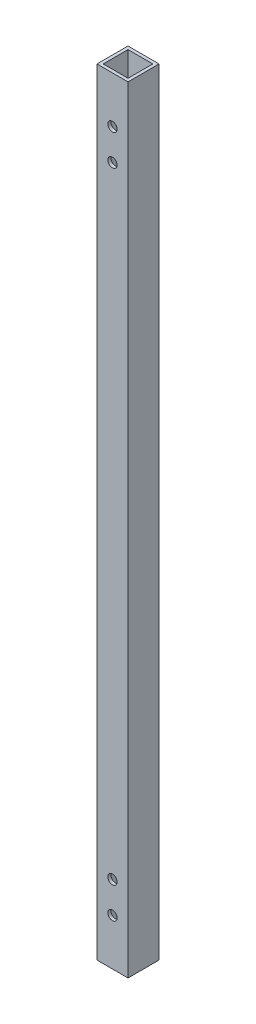
from build123d import *

# Parameters (mm, degrees)
SKETCH_1_W            = 10
SKETCH_1_H            = 10
SKETCH_1_W_2          = 8
SKETCH_1_H_2          = 8
EXTRUDE_1_DEPTH       = 250
HOLE_WIZARD_3_0_3_1_D = 3


with BuildPart() as part:
    # 草图1 → 凸台-拉伸1 (new body)
    with BuildSketch(Plane(origin=(0, 0, 0), x_dir=(1, 0, 0), z_dir=(0, 1, 0))):
        Rectangle(SKETCH_1_W, SKETCH_1_H)
        Rectangle(SKETCH_1_W_2, SKETCH_1_H_2, mode=Mode.SUBTRACT)
    extrude(amount=EXTRUDE_1_DEPTH)

    # Ø3.0 (3) 直径孔1 (through all)
    with Locations(Plane.XY.offset(5)):
        with Locations((0, 15), (0, 25)):
            hole_wizard_3_0_3_1 = Hole(HOLE_WIZARD_3_0_3_1_D / 2)

    # 镜向1: Ø3.0 (3) 直径孔1 across plane
    add(hole_wizard_3_0_3_1.mirror(Plane(origin=(0, 125, 0), x_dir=(0, 0, 1), z_dir=(0, -1, 0))), mode=Mode.SUBTRACT)


solid = part.part
